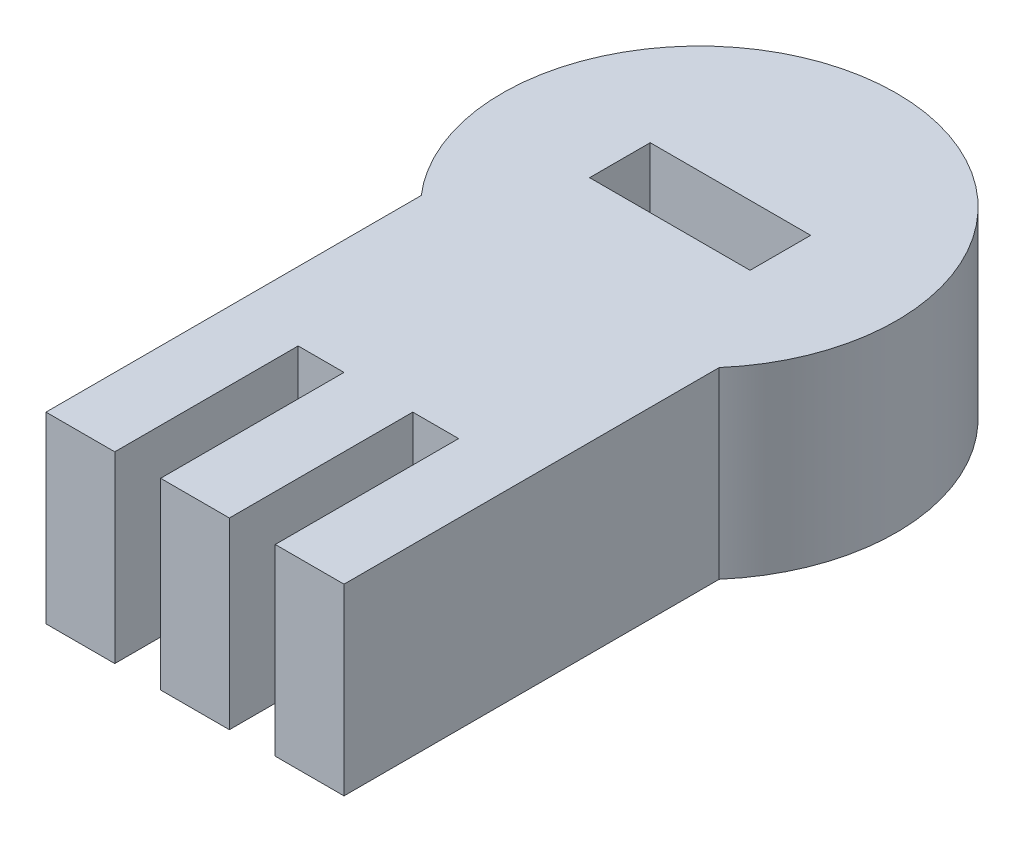
from build123d import *

# Parameters (mm, degrees)
SKETCH1_W           = 3.5
SKETCH1_H           = 1.322228747
BOSS_EXTRUDE1_DEPTH = 4


with BuildPart() as part:
    # Sketch1 → Boss-Extrude1 (new body)
    with BuildSketch(Plane(origin=(0, 0, 0), x_dir=(1, 0, 0), z_dir=(0, 1, 0))):
        with BuildLine():
            Line((0, 0), (0, -4))
            Line((0, -4), (1.5, -4))
            Line((1.5, -4), (1.5, 0))
            Line((1.5, 0), (2.5, 0))
            Line((2.5, 0), (2.5, -4))
            Line((2.5, -4), (4, -4))
            Line((4, -4), (4, 0))
            Line((4, 0), (5, 0))
            Line((5, 0), (5, -4))
            Line((5, -4), (6.5, -4))
            Line((6.5, -4), (6.5, 0))
            Line((6.5, 0), (6.5, 4.184418355))
            ThreePointArc((6.5, 4.184418355), (3.25, 11.3), (0, 4.184418355))
            Line((0, 4.184418355), (0, 0))
        make_face()
        with Locations((3.25, 7.017797312)):
            Rectangle(SKETCH1_W, SKETCH1_H, mode=Mode.SUBTRACT)
    extrude(amount=BOSS_EXTRUDE1_DEPTH)


solid = part.part
